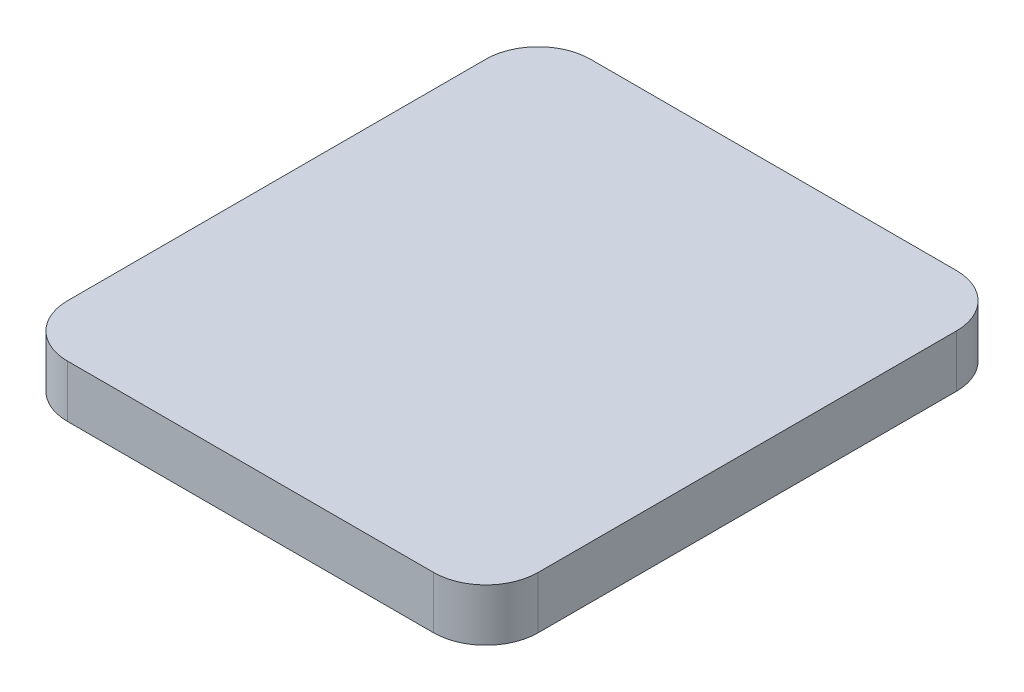
from build123d import *

# Parameters (mm, degrees)
SKETCH1_W           = 90
SKETCH1_H           = 100
BOSS_EXTRUDE1_DEPTH = 10
FILLET1_R           = 10


with BuildPart() as part:
    # Sketch1 → Boss-Extrude1 (new body)
    with BuildSketch(Plane(origin=(0, 0, 0), x_dir=(1, 0, 0), z_dir=(0, 1, 0))):
        with Locations((-45, -50)):
            Rectangle(SKETCH1_W, SKETCH1_H)
    extrude(amount=BOSS_EXTRUDE1_DEPTH)

    # Fillet1
    fillet1_edges = [part.edges().sort_by_distance(p)[0] for p in [
        (0, 5, 100),
        (-90, 5, 100),
        (-90, 5, 0),
        (0, 5, 0),
    ]]
    fillet(fillet1_edges, radius=FILLET1_R)


solid = part.part
